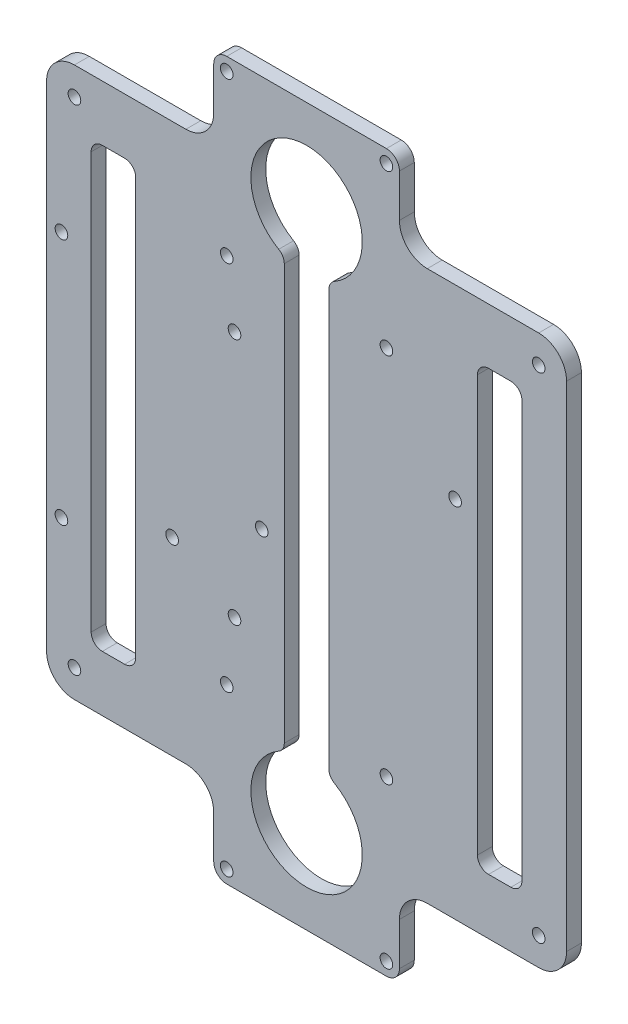
from build123d import *

# Parameters (mm, degrees)
SKETCH_1_R          = 15
EXTRUDE_1_DEPTH     = 4
HOLE_WIZARD_M3_1_D  = 3.4
FILLET_7_R          = 7.5
FILLET_8_R          = 3.5
SKETCH_4_W          = 12
SKETCH_4_H          = 118
CUT_EXTRUDE_1_DEPTH = 221.649609109
FILLET_9_R          = 3


with BuildPart() as part:
    # ｽｹｯﾁ1 → ﾎﾞｽ - 押し出し1 (new body)
    with BuildSketch(Plane(origin=(0, 0, 0), x_dir=(0, 1, 0), z_dir=(0, 0, 1))):
        Polygon((0, 0), (148, 0), (148, 45), (170.5, 45), (170.5, 95), (148, 95), (148, 140), (0, 140), (0, 95), (-22.5, 95), (-22.5, 45), (0, 45), align=None)
        with Locations(Location((2.5, 70, 0), (0, 0, 270))):
            Circle(SKETCH_1_R, mode=Mode.SUBTRACT)
        with Locations(Location((145.5, 70, 0), (0, 0, 90))):
            Circle(SKETCH_1_R, mode=Mode.SUBTRACT)
    extrude(amount=EXTRUDE_1_DEPTH)

    # M3 すきま穴1 (through all)
    with Locations(Plane.XY.offset(4)):
        with Locations((-132.5, 140.5), (-7.5, 140.5), (-106.2, 51.02), (-30, 98.01), (-7.5, 7.5), (-132.5, 7.5), (-82.07, 64.99), (-136, 107.3), (-89.4, 107.3), (-89.4, 40.7), (-136, 40.7), (-91.5, 24), (-48.5, 24), (-48.5, -19), (-91.5, -19), (-91.5, 167), (-48.5, 167), (-48.5, 124), (-91.5, 124)):
            Hole(HOLE_WIZARD_M3_1_D / 2)

    # ﾌｨﾚｯﾄ7
    fillet_7_edges = [part.edges().sort_by_distance(p)[0] for p in [
        (-45, 0, 2),
        (-95, 0, 2),
        (-140, 0, 2),
        (-140, 148, 2),
        (-95, 148, 2),
        (-45, 148, 2),
        (0, 148, 2),
        (0, 0, 2),
    ]]
    fillet(fillet_7_edges, radius=FILLET_7_R)

    # ﾌｨﾚｯﾄ8
    fillet_8_edges = [part.edges().sort_by_distance(p)[0] for p in [
        (-45, -22.5, 2),
        (-95, -22.5, 2),
        (-95, 170.5, 2),
        (-45, 170.5, 2),
    ]]
    fillet(fillet_8_edges, radius=FILLET_8_R)

    # ｽｹｯﾁ4 → ｶｯﾄ - 押し出し1 (cut, through all)
    with BuildSketch(Plane.XY.offset(4)):
        with Locations((-122, 74)):
            Rectangle(SKETCH_4_W, SKETCH_4_H)
        with BuildLine():
            Line((-64, 145.5), (-64, 2.5))
            ThreePointArc((-64, 2.5), (-70, -3.5), (-76, 2.5))
            Line((-76, 2.5), (-76, 145.5))
            ThreePointArc((-76, 145.5), (-70, 151.5), (-64, 145.5))
        make_face()
        with Locations((-18, 74)):
            Rectangle(SKETCH_4_W, SKETCH_4_H)
    extrude(amount=-CUT_EXTRUDE_1_DEPTH, mode=Mode.SUBTRACT)

    # ﾌｨﾚｯﾄ9
    fillet_9_edges = [part.edges().sort_by_distance(p)[0] for p in [
        (-76, 131.752272915, 2),
        (-64, 131.752272915, 2),
        (-128, 15, 2),
        (-128, 133, 2),
        (-116, 133, 2),
        (-116, 15, 2),
        (-64, 16.247727085, 2),
        (-76, 16.247727085, 2),
        (-12, 133, 2),
        (-12, 15, 2),
        (-24, 15, 2),
        (-24, 133, 2),
    ]]
    fillet(fillet_9_edges, radius=FILLET_9_R)


solid = part.part
